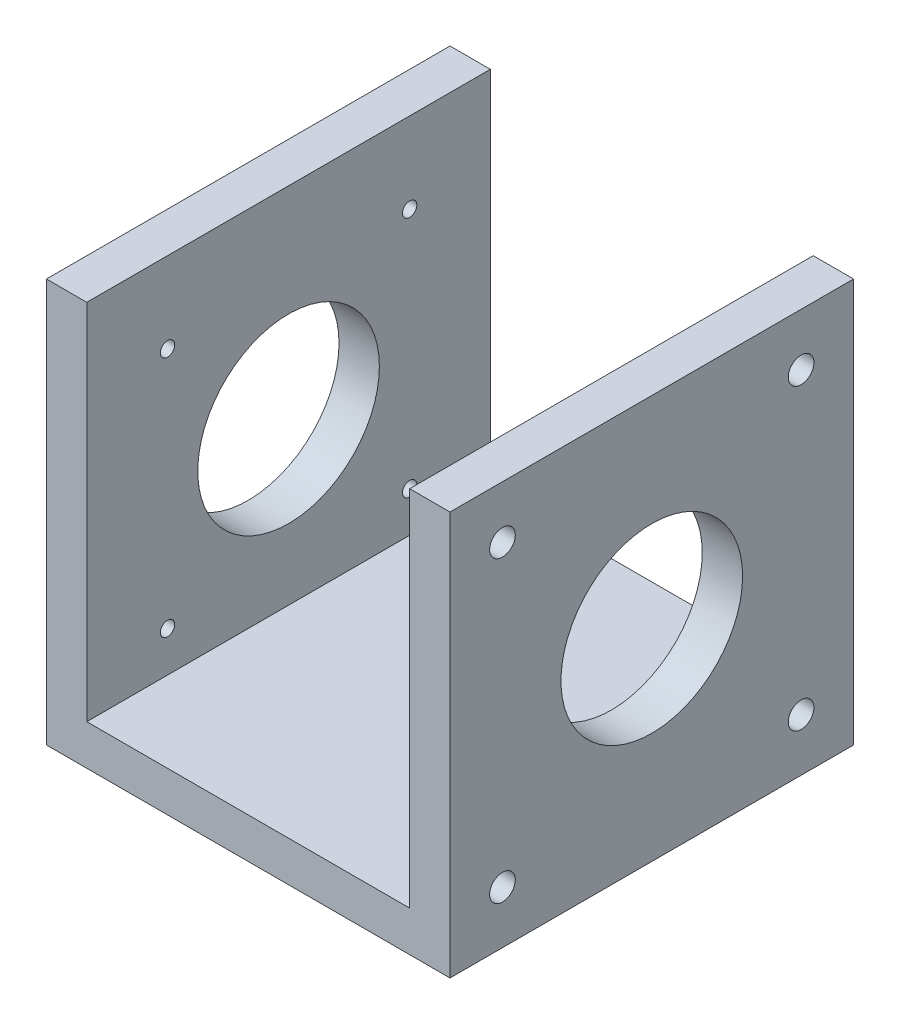
from build123d import *

# Parameters (mm, degrees)
SKETCH1_3_W                     = 6.35
SKETCH1_3_H                     = 63.5
BOSS_EXTRUDE1_DEPTH             = 63.5
SKETCH1_W                       = 50.8
SKETCH1_H                       = 63.5
BOSS_EXTRUDE2_DEPTH             = 6.35
SKETCH1_6_W                     = 6.35
SKETCH1_6_H                     = 63.5
BOSS_EXTRUDE3_DEPTH             = 63.5
SKETCH2_R                       = 14.2875
CUT_EXTRUDE1_DEPTH              = 96.25
F_43_0_089_DIAMETER_HOLE1_D     = 2.2606
F_43_0_089_DIAMETER_HOLE1_DEPTH = 25.4
F_43_0_089_DIAMETER_HOLE1_TIP   = 0.679152758
F_10_32_TAPPED_HOLE1_D          = 4.0386
F_10_32_TAPPED_HOLE1_DEPTH      = 6.35


with BuildPart() as part:
    # Sketch1<3> → Boss-Extrude1 (new body)
    with BuildSketch(Plane(origin=(0, 0, 0), x_dir=(1, 0, 0), z_dir=(0, 1, 0))):
        with Locations((28.575, 0)):
            Rectangle(SKETCH1_3_W, SKETCH1_3_H)
    extrude(amount=BOSS_EXTRUDE1_DEPTH)

    # Sketch1 → Boss-Extrude2 (add)
    with BuildSketch(Plane(origin=(0, 0, 0), x_dir=(1, 0, 0), z_dir=(0, 1, 0))):
        Rectangle(SKETCH1_W, SKETCH1_H)
    extrude(amount=BOSS_EXTRUDE2_DEPTH)

    # Sketch1<6> → Boss-Extrude3 (add)
    with BuildSketch(Plane(origin=(0, 0, 0), x_dir=(1, 0, 0), z_dir=(0, 1, 0))):
        with Locations((-28.575, 0)):
            Rectangle(SKETCH1_6_W, SKETCH1_6_H)
    extrude(amount=BOSS_EXTRUDE3_DEPTH)

    # Sketch2 → Cut-Extrude1 (cut, through all)
    with BuildSketch(Plane(origin=(31.75, 0, 0), x_dir=(0, 0, -1), z_dir=(1, 0, 0))):
        with Locations((0, 31.75)):
            Circle(SKETCH2_R)
    extrude(amount=-CUT_EXTRUDE1_DEPTH, mode=Mode.SUBTRACT)

    # #43 (0.089) Diameter Hole1
    with Locations(Plane.ZY.offset(31.75)):
        with Locations((-19.05, 50.8), (19.05, 50.8), (19.05, 12.7), (-19.05, 12.7)):
            Hole(F_43_0_089_DIAMETER_HOLE1_D / 2, depth=F_43_0_089_DIAMETER_HOLE1_DEPTH)
            with Locations((0, 0, -(F_43_0_089_DIAMETER_HOLE1_DEPTH + F_43_0_089_DIAMETER_HOLE1_TIP / 2))):  # 118° drill point
                Cone(0, F_43_0_089_DIAMETER_HOLE1_D / 2, F_43_0_089_DIAMETER_HOLE1_TIP, mode=Mode.SUBTRACT)

    # #10-32 Tapped Hole1
    with Locations(Plane(origin=(31.75, 0, 0), x_dir=(0, 0, -1), z_dir=(1, 0, 0))):
        with Locations((-23.495, 55.245), (23.495, 55.245), (23.495, 8.255), (-23.495, 8.255)):
            Hole(F_10_32_TAPPED_HOLE1_D / 2, depth=F_10_32_TAPPED_HOLE1_DEPTH)


solid = part.part
